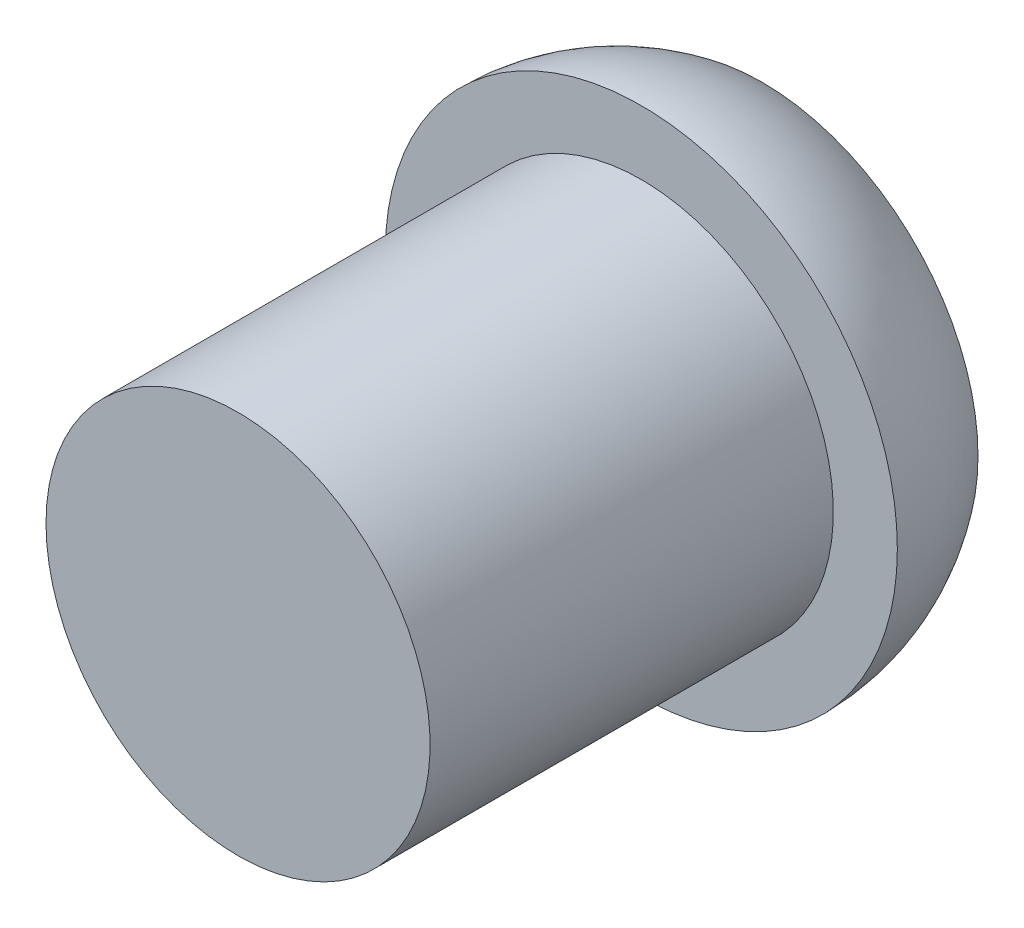
from build123d import *


with BuildPart() as part:
    # Sketch1 → Revolve1 (revolve)
    with BuildSketch(Plane(origin=(0, 0, 0), x_dir=(1, 0, 0), z_dir=(0, 1, 0)), mode=Mode.PRIVATE) as revolve1_sk:
        with BuildLine():
            Line((0, -10), (4.7625, -10))
            Line((4.7625, -10), (4.7625, 0))
            Line((4.7625, 0), (6.35, 0))
            ThreePointArc((6.35, 0), (6.09341649, 1.58113883), (5.35, 3))
            Line((5.35, 3), (3.464101615, 3))
            ThreePointArc((3.464101615, 3), (2, 4.464101615), (0, 5))
            Line((0, 5), (0, -10))
        make_face()
    revolve(revolve1_sk.sketch.rotate(Axis((0, 0, -5), (0, 0, 1)), 180), axis=Axis((0, 0, -5), (0, 0, 1)))


solid = part.part
